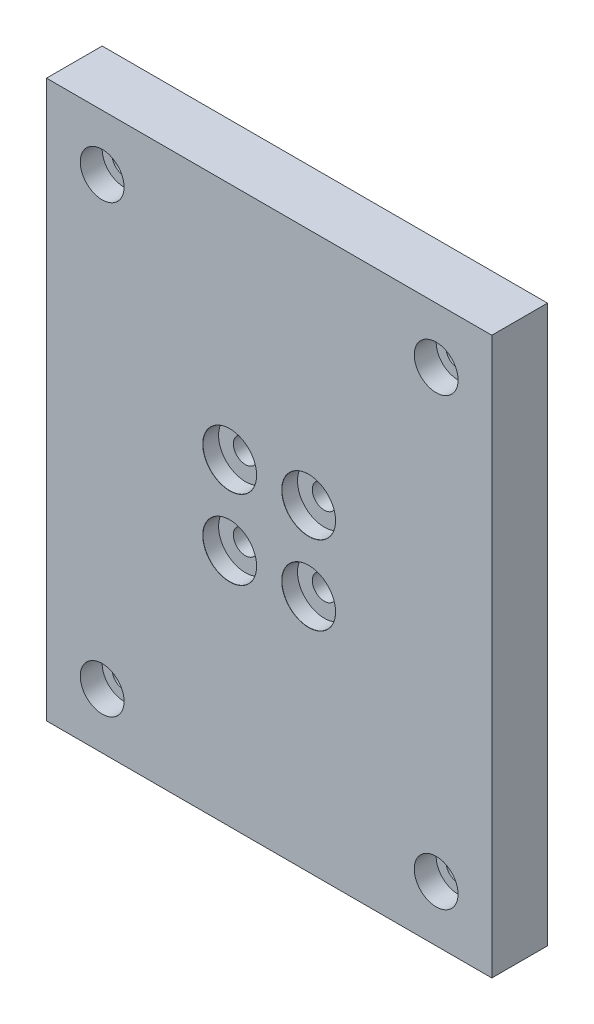
from build123d import *

# Parameters (mm, degrees)
SKETCH1_W                              = 101.6
SKETCH1_H                              = 127
BOSS_EXTRUDE1_DEPTH                    = 12.7
CBORE_FOR_M5_HEX_HEAD_BOLT1_AT_2_COUNT = 2
CBORE_FOR_M5_HEX_HEAD_BOLT1_AT_2_PITCH = 18.0086
CBORE_FOR_M5_HEX_HEAD_BOLT1_AT_3_COUNT = 2
CBORE_FOR_M5_HEX_HEAD_BOLT1_AT_3_PITCH = 25.461925967
CBORE_FOR_M5_HEX_HEAD_BOLT1_AT_4_COUNT = 2
CBORE_FOR_M5_HEX_HEAD_BOLT1_AT_4_PITCH = 18
CBORE_FOR_M5_SHCS1_D                   = 5.5
CBORE_FOR_M5_SHCS1_CBORE_D             = 10
CBORE_FOR_M5_SHCS1_CBORE_DEPTH         = 5


with BuildPart() as part:
    # Sketch1 → Boss-Extrude1 (new body)
    with BuildSketch(Plane.XY):
        with Locations((50.8, 63.5)):
            Rectangle(SKETCH1_W, SKETCH1_H)
    extrude(amount=BOSS_EXTRUDE1_DEPTH)

    # Sketch8 → CBORE for M5 Hex Head Bolt1 (revolve, cut)
    with BuildSketch(Plane(origin=(41.7957, 72.5, 12.7), x_dir=(0, -1, 0), z_dir=(1, 0, 0))):
        Polygon((0, 0), (0, 12.7), (2.75, 12.7), (2.75, 3.58), (6.12, 3.58), (6.12, 0.025), (6.145, 0), align=None)
    cbore_for_m5_hex_head_bolt1 = revolve(axis=Axis((41.7957, 72.5, 19.05), (0, 0, -1)), mode=Mode.SUBTRACT)

    # CBORE for M5 Hex Head Bolt1 at 2: CBORE for M5 Hex Head Bolt1 ×2
    with Locations(*[(i * CBORE_FOR_M5_HEX_HEAD_BOLT1_AT_2_PITCH, 0, 0) for i in range(1, CBORE_FOR_M5_HEX_HEAD_BOLT1_AT_2_COUNT)]):
        add(cbore_for_m5_hex_head_bolt1, mode=Mode.SUBTRACT)

    # CBORE for M5 Hex Head Bolt1 at 3: CBORE for M5 Hex Head Bolt1 ×2
    with Locations(*[Vector(0.7072756406246394, -0.7069378814146302, 0) * (i * CBORE_FOR_M5_HEX_HEAD_BOLT1_AT_3_PITCH) for i in range(1, CBORE_FOR_M5_HEX_HEAD_BOLT1_AT_3_COUNT)]):
        add(cbore_for_m5_hex_head_bolt1, mode=Mode.SUBTRACT)

    # CBORE for M5 Hex Head Bolt1 at 4: CBORE for M5 Hex Head Bolt1 ×2
    with Locations(*[(0, -i * CBORE_FOR_M5_HEX_HEAD_BOLT1_AT_4_PITCH, 0) for i in range(1, CBORE_FOR_M5_HEX_HEAD_BOLT1_AT_4_COUNT)]):
        add(cbore_for_m5_hex_head_bolt1, mode=Mode.SUBTRACT)

    # CBORE for M5 SHCS1 (through all)
    with Locations(Plane.XY.offset(12.7)):
        with Locations((12.7, 114.3), (88.9, 114.3), (88.9, 12.7), (12.7, 12.7)):
            CounterBoreHole(CBORE_FOR_M5_SHCS1_D / 2, CBORE_FOR_M5_SHCS1_CBORE_D / 2, CBORE_FOR_M5_SHCS1_CBORE_DEPTH)


solid = part.part
